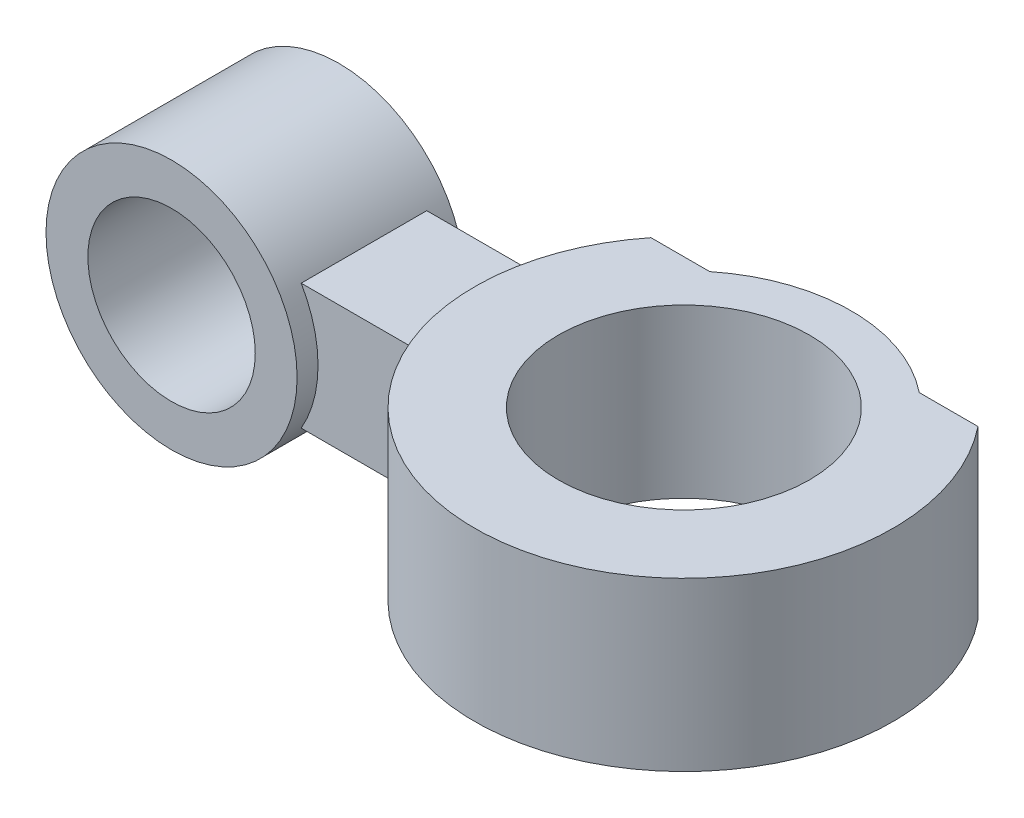
from build123d import *

# Parameters (mm, degrees)
SKETCH_1_R      = 1.5
SKETCH_1_R_2    = 1
EXTRUDE_1_DEPTH = 2
SKETCH_6_R      = 1.5
EXTRUDE_2_DEPTH = 1
EXTRUDE_3_DEPTH = 0.75
EXTRUDE_4_REACH = 8.98
SKETCH_10_W     = 1.5
SKETCH_10_H     = 1.5


with BuildPart() as part:
    # 草图1 → 凸台-拉伸1 (new body)
    with BuildSketch(Plane.XY):
        Circle(SKETCH_1_R)
        Circle(SKETCH_1_R_2, mode=Mode.SUBTRACT)
    extrude(amount=EXTRUDE_1_DEPTH)

    # 草图8 → 凸台-拉伸3 (add, symmetric)
    with BuildSketch(Plane.XY.offset(1)):
        with BuildLine():
            Line((1.299038106, 0.75), (1.771810874, 0.75))
            Line((1.771810874, 0.75), (1.771810874, -0.75))
            Line((1.771810874, -0.75), (1.299038106, -0.75))
            ThreePointArc((1.299038106, -0.75), (1.5, 0), (1.299038106, 0.75))
        make_face()
    extrude(amount=EXTRUDE_3_DEPTH, both=True)


with BuildPart() as body_2:
    # 草图6 → 凸台-拉伸2 (new, symmetric)
    with BuildSketch(Plane(origin=(0, 0, 0), x_dir=(1, 0, 0), z_dir=(0, 1, 0))):
        with BuildLine():
            Line((6.372879371, 0.56), (7.074881195, 0.56))
            ThreePointArc((7.074881195, 0.56), (5.121320344, -3.5), (3.167759492, 0.56))
            Line((3.167759492, 0.56), (3.869761316, 0.56))
            ThreePointArc((3.869761316, 0.56), (5.121320344, 1), (6.372879371, 0.56))
        make_face()
        with Locations((5.121320344, -1)):
            Circle(SKETCH_6_R, mode=Mode.SUBTRACT)
    extrude(amount=EXTRUDE_2_DEPTH, both=True)

    # 草图10 → 凸台-拉伸4 (add, up to next)
    with BuildSketch(Plane(origin=(1.771810874, 0, 0), x_dir=(0, 0, -1), z_dir=(1, 0, 0)), mode=Mode.PRIVATE) as extrude_4_sk1:
        with Locations((-1, 0)):
            Rectangle(SKETCH_10_W, SKETCH_10_H)
    extrude_4_tool1 = extrude(extrude_4_sk1.sketch, amount=EXTRUDE_4_REACH, mode=Mode.PRIVATE) - body_2.part

    add(part.part)  # 凸台-拉伸4 merges part
    add(extrude_4_tool1.solids().sort_by_distance((1.771811, 0, 1))[0])


solid = body_2.part
